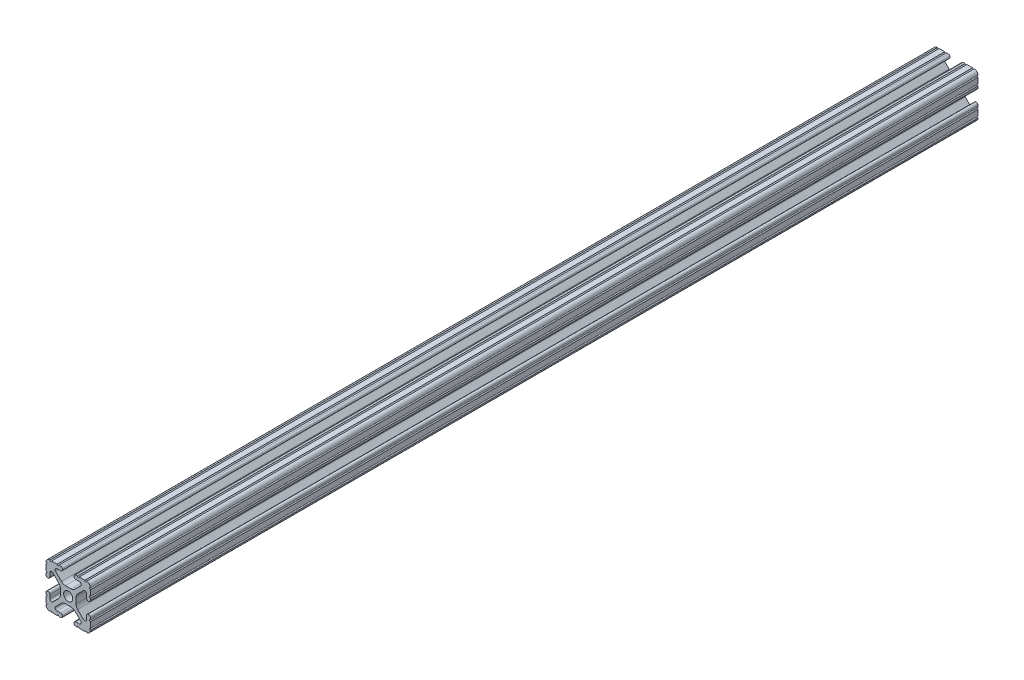
from build123d import *

# Parameters (mm, degrees)
SKETCH1_R           = 2.6035
BOSS_EXTRUDE1_DEPTH = 508


with BuildPart() as part:
    # Sketch1 → Boss-Extrude1 (new body)
    with BuildSketch(Plane.XY):
        with BuildLine():
            Line((-12.7, -6.3330836), (-12.7, -9.5504))
            ThreePointArc((-12.7, -9.5504), (-12.192000006, -10.058323491), (-12.699846982, -10.566399977))
            ThreePointArc((-12.699846982, -10.566399977), (-12.082522516, -12.082522516), (-10.566399977, -12.699846982))
            ThreePointArc((-10.566399977, -12.699846982), (-10.058323491, -12.192000006), (-9.5504, -12.7))
            Line((-9.5504, -12.7), (-6.3330836, -12.7))
            ThreePointArc((-6.3330836, -12.7), (-5.8250836, -12.192), (-5.3170836, -12.7))
            Line((-5.3170836, -12.7), (-4.343399971, -12.7))
            ThreePointArc((-4.343399971, -12.7), (-3.238499971, -11.5951), (-4.343399971, -10.4902))
            Line((-4.343399971, -10.4902), (-6.474794456, -10.4902))
            ThreePointArc((-6.474794456, -10.4902), (-7.413456061, -9.863006367), (-7.193214945, -8.75577951))
            Line((-7.193214945, -8.75577951), (-3.863171405, -5.42573597))
            ThreePointArc((-3.863171405, -5.42573597), (-2.833127272, -4.737482484), (-1.618107374, -4.4958))
            Line((-1.618107374, -4.4958), (1.618107374, -4.4958))
            ThreePointArc((1.618107374, -4.4958), (2.833127272, -4.737482484), (3.863171405, -5.42573597))
            Line((3.863171405, -5.42573597), (7.193214945, -8.75577951))
            ThreePointArc((7.193214945, -8.75577951), (7.413456061, -9.863006367), (6.474794456, -10.4902))
            Line((6.474794456, -10.4902), (4.3434, -10.4902))
            ThreePointArc((4.3434, -10.4902), (3.2385, -11.5951), (4.3434, -12.7))
            Line((4.3434, -12.7), (5.3170836, -12.7))
            ThreePointArc((5.3170836, -12.7), (5.8250836, -12.192), (6.3330836, -12.7))
            Line((6.3330836, -12.7), (9.5504, -12.7))
            ThreePointArc((9.5504, -12.7), (10.058323491, -12.192000006), (10.566399977, -12.699846982))
            ThreePointArc((10.566399977, -12.699846982), (12.082522516, -12.082522516), (12.699846982, -10.566399977))
            ThreePointArc((12.699846982, -10.566399977), (12.192000006, -10.058323491), (12.7, -9.5504))
            Line((12.7, -9.5504), (12.7, -6.3330836))
            ThreePointArc((12.7, -6.3330836), (12.192, -5.8250836), (12.7, -5.3170836))
            Line((12.7, -5.3170836), (12.7, -4.343399971))
            ThreePointArc((12.7, -4.343399971), (11.5951, -3.238499971), (10.4902, -4.343399971))
            Line((10.4902, -4.343399971), (10.4902, -6.474794456))
            ThreePointArc((10.4902, -6.474794456), (9.863006367, -7.413456061), (8.75577951, -7.193214945))
            Line((8.75577951, -7.193214945), (5.42573597, -3.863171405))
            ThreePointArc((5.42573597, -3.863171405), (4.737482484, -2.833127272), (4.4958, -1.618107374))
            Line((4.4958, -1.618107374), (4.4958, 1.618107374))
            ThreePointArc((4.4958, 1.618107374), (4.737482484, 2.833127272), (5.42573597, 3.863171405))
            Line((5.42573597, 3.863171405), (8.75577951, 7.193214945))
            ThreePointArc((8.75577951, 7.193214945), (9.863006367, 7.413456061), (10.4902, 6.474794456))
            Line((10.4902, 6.474794456), (10.4902, 4.3434))
            ThreePointArc((10.4902, 4.3434), (11.5951, 3.2385), (12.7, 4.3434))
            Line((12.7, 4.3434), (12.7, 5.3170836))
            ThreePointArc((12.7, 5.3170836), (12.192, 5.8250836), (12.7, 6.3330836))
            Line((12.7, 6.3330836), (12.7, 9.5504))
            ThreePointArc((12.7, 9.5504), (12.192000006, 10.058323491), (12.699846982, 10.566399977))
            ThreePointArc((12.699846982, 10.566399977), (12.082522516, 12.082522516), (10.566399977, 12.699846982))
            ThreePointArc((10.566399977, 12.699846982), (10.058323491, 12.192000006), (9.5504, 12.7))
            Line((9.5504, 12.7), (6.3330836, 12.7))
            ThreePointArc((6.3330836, 12.7), (5.8250836, 12.192), (5.3170836, 12.7))
            Line((5.3170836, 12.7), (4.343399971, 12.7))
            ThreePointArc((4.343399971, 12.7), (3.238499971, 11.5951), (4.343399971, 10.4902))
            Line((4.343399971, 10.4902), (6.474794456, 10.4902))
            ThreePointArc((6.474794456, 10.4902), (7.413456061, 9.863006367), (7.193214945, 8.75577951))
            Line((7.193214945, 8.75577951), (3.863171405, 5.42573597))
            ThreePointArc((3.863171405, 5.42573597), (2.833127272, 4.737482484), (1.618107374, 4.4958))
            Line((1.618107374, 4.4958), (-1.618107374, 4.4958))
            ThreePointArc((-1.618107374, 4.4958), (-2.833127272, 4.737482484), (-3.863171405, 5.42573597))
            Line((-3.863171405, 5.42573597), (-7.193214945, 8.75577951))
            ThreePointArc((-7.193214945, 8.75577951), (-7.413456061, 9.863006367), (-6.474794456, 10.4902))
            Line((-6.474794456, 10.4902), (-4.3434, 10.4902))
            ThreePointArc((-4.3434, 10.4902), (-3.2385, 11.5951), (-4.3434, 12.7))
            Line((-4.3434, 12.7), (-5.3170836, 12.7))
            ThreePointArc((-5.3170836, 12.7), (-5.8250836, 12.192), (-6.3330836, 12.7))
            Line((-6.3330836, 12.7), (-9.5504, 12.7))
            ThreePointArc((-9.5504, 12.7), (-10.058323491, 12.192000006), (-10.566399977, 12.699846982))
            ThreePointArc((-10.566399977, 12.699846982), (-12.082522516, 12.082522516), (-12.699846982, 10.566399977))
            ThreePointArc((-12.699846982, 10.566399977), (-12.192000006, 10.058323491), (-12.7, 9.5504))
            Line((-12.7, 9.5504), (-12.7, 6.3330836))
            ThreePointArc((-12.7, 6.3330836), (-12.192, 5.8250836), (-12.7, 5.3170836))
            Line((-12.7, 5.3170836), (-12.7, 4.343399971))
            ThreePointArc((-12.7, 4.343399971), (-11.5951, 3.238499971), (-10.4902, 4.343399971))
            Line((-10.4902, 4.343399971), (-10.4902, 6.474794456))
            ThreePointArc((-10.4902, 6.474794456), (-9.863006367, 7.413456061), (-8.75577951, 7.193214945))
            Line((-8.75577951, 7.193214945), (-5.42573597, 3.863171405))
            ThreePointArc((-5.42573597, 3.863171405), (-4.737482484, 2.833127272), (-4.4958, 1.618107374))
            Line((-4.4958, 1.618107374), (-4.4958, -1.618107374))
            ThreePointArc((-4.4958, -1.618107374), (-4.737482484, -2.833127272), (-5.42573597, -3.863171405))
            Line((-5.42573597, -3.863171405), (-8.75577951, -7.193214945))
            ThreePointArc((-8.75577951, -7.193214945), (-9.863006367, -7.413456061), (-10.4902, -6.474794456))
            Line((-10.4902, -6.474794456), (-10.4902, -4.3434))
            ThreePointArc((-10.4902, -4.3434), (-11.5951, -3.2385), (-12.7, -4.3434))
            Line((-12.7, -4.3434), (-12.7, -5.3170836))
            ThreePointArc((-12.7, -5.3170836), (-12.192, -5.8250836), (-12.7, -6.3330836))
        make_face()
        with Locations(Location((0, 0, 0), (0, 0, 180))):
            Circle(SKETCH1_R, mode=Mode.SUBTRACT)
    extrude(amount=-BOSS_EXTRUDE1_DEPTH)


solid = part.part
